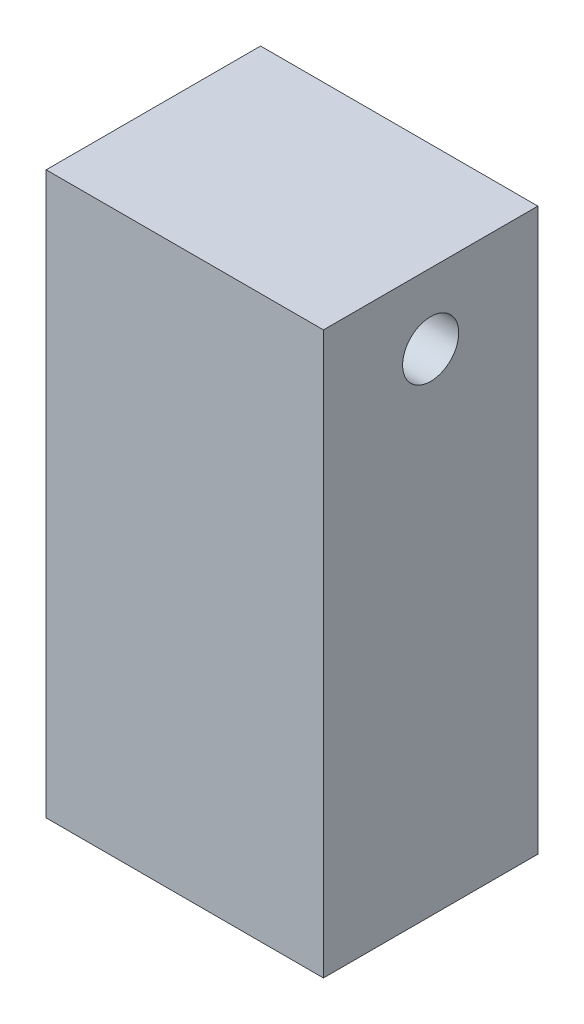
from build123d import *

# Parameters (mm, degrees)
SKETCH1_W           = 3.1369
SKETCH1_H           = 2.4257
BOSS_EXTRUDE1_DEPTH = 6.35
SKETCH2_R           = 0.3175
CUT_EXTRUDE1_DEPTH  = 8.254148952


with BuildPart() as part:
    # Sketch1 → Boss-Extrude1 (new body)
    with BuildSketch(Plane(origin=(0, 0, 0), x_dir=(1, 0, 0), z_dir=(0, 1, 0))):
        Rectangle(SKETCH1_W, SKETCH1_H)
    extrude(amount=BOSS_EXTRUDE1_DEPTH)

    # Sketch2 → Cut-Extrude1 (cut, through all)
    with BuildSketch(Plane(origin=(-1.56845, 0, 0.3556), x_dir=(0, 0, -1), z_dir=(1, 0, 0))):
        with Locations((0.3556, 5.55625)):
            Circle(SKETCH2_R)
    extrude(amount=CUT_EXTRUDE1_DEPTH, mode=Mode.SUBTRACT)


solid = part.part
